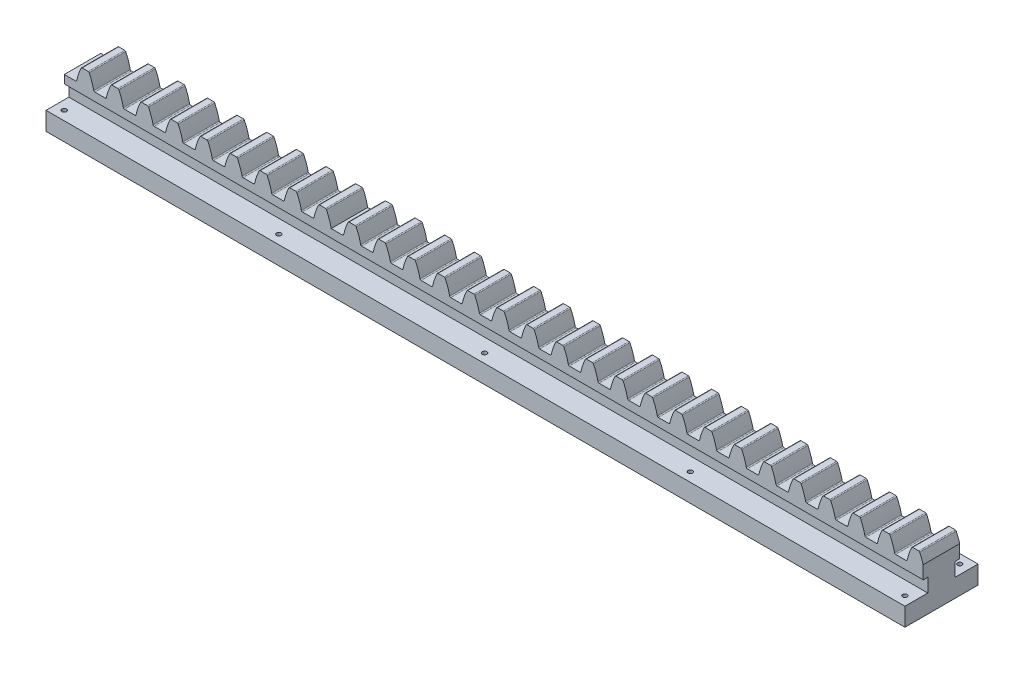
from build123d import *

# Parameters (mm, degrees)
BOSS_EXTRUDE2_DEPTH = 298.6405
CUT_EXTRUDE4_DEPTH  = 331.355130858
LPATTERN1_COUNT     = 30
LPATTERN1_PITCH     = 20.6248
FILLET1_R           = 0.762
SKETCH4_R           = 1.5875
CUT_EXTRUDE2_DEPTH  = 301.793065479


with BuildPart() as part:
    # Sketch1 → Boss-Extrude2 (new, symmetric)
    with BuildSketch(Plane(origin=(0, 0, 0), x_dir=(0, 0, -1), z_dir=(1, 0, 0))):
        Polygon((25.4, 0), (-25.4, 0), (-25.4, 12.7), (-9.525, 12.7), (-9.525, 22.225), (-12.7, 22.225), (-12.7, 38.1), (12.7, 38.1), (12.7, 22.225), (9.525, 22.225), (9.525, 12.7), (25.4, 12.7), align=None)
    extrude(amount=BOSS_EXTRUDE2_DEPTH, both=True)

    # Sketch6 → Cut-Extrude4 (cut, symmetric)
    with BuildSketch(Plane(origin=(23.474580109, 68.783919997, 0), x_dir=(1, 0, 0), z_dir=(0, 0, -1))):
        with BuildLine():
            Line((-322.115080109, 40.843919997), (-313.615080109, 40.843919997))
            ThreePointArc((-313.615080109, 40.843919997), (-312.202371676, 35.647727036), (-310.115080109, 30.683919997))
            Line((-310.115080109, 30.683919997), (-325.615080109, 30.683919997))
            ThreePointArc((-325.615080109, 30.683919997), (-323.527788542, 35.647727036), (-322.115080109, 40.843919997))
        make_face()
    cut_extrude4 = extrude(amount=CUT_EXTRUDE4_DEPTH, both=True, mode=Mode.SUBTRACT)

    # LPattern1: Cut-Extrude4 ×30
    with Locations(*[(i * LPATTERN1_PITCH, 0, 0) for i in range(1, LPATTERN1_COUNT)]):
        add(cut_extrude4, mode=Mode.SUBTRACT)

    # Fillet1
    fillet1_edges = [part.edges().sort_by_distance(p)[0] for p in [
        (-224.7661, 38.1, 0),
        (-219.6413, 38.1, 0),
        (-216.1413, 27.94, 0),
        (-207.6413, 27.94, 0),
        (-204.1413, 38.1, 0),
        (-199.0165, 38.1, 0),
        (-195.5165, 27.94, 0),
        (-187.0165, 27.94, 0),
        (-183.5165, 38.1, 0),
        (-178.3917, 38.1, 0),
        (-174.8917, 27.94, 0),
        (-166.3917, 27.94, 0),
        (-162.8917, 38.1, 0),
        (-157.7669, 38.1, 0),
        (-154.2669, 27.94, 0),
        (-145.7669, 27.94, 0),
        (-142.2669, 38.1, 0),
        (-137.1421, 38.1, 0),
        (-133.6421, 27.94, 0),
        (-125.1421, 27.94, 0),
        (-121.6421, 38.1, 0),
        (-116.5173, 38.1, 0),
        (-104.5173, 27.94, 0),
        (-101.0173, 38.1, 0),
        (-95.8925, 38.1, 0),
        (-92.3925, 27.94, 0),
        (-83.8925, 27.94, 0),
        (-80.3925, 38.1, 0),
        (-75.2677, 38.1, 0),
        (-71.7677, 27.94, 0),
        (-63.2677, 27.94, 0),
        (-59.7677, 38.1, 0),
        (-54.6429, 38.1, 0),
        (-51.1429, 27.94, 0),
        (-42.6429, 27.94, 0),
        (-39.1429, 38.1, 0),
        (-34.0181, 38.1, 0),
        (-30.5181, 27.94, 0),
        (-22.0181, 27.94, 0),
        (-18.5181, 38.1, 0),
        (-13.3933, 38.1, 0),
        (-9.8933, 27.94, 0),
        (-1.3933, 27.94, 0),
        (2.1067, 38.1, 0),
        (7.2315, 38.1, 0),
        (10.7315, 27.94, 0),
        (19.2315, 27.94, 0),
        (22.7315, 38.1, 0),
        (27.8563, 38.1, 0),
        (31.3563, 27.94, 0),
        (39.8563, 27.94, 0),
        (43.3563, 38.1, 0),
        (-290.1405, 27.94, 0),
        (-286.6405, 38.1, 0),
        (48.4811, 38.1, 0),
        (51.9811, 27.94, 0),
        (60.4811, 27.94, 0),
        (63.9811, 38.1, 0),
        (69.1059, 38.1, 0),
        (72.6059, 27.94, 0),
        (81.1059, 27.94, 0),
        (84.6059, 38.1, 0),
        (89.7307, 38.1, 0),
        (93.2307, 27.94, 0),
        (101.7307, 27.94, 0),
        (105.2307, 38.1, 0),
        (110.3555, 38.1, 0),
        (113.8555, 27.94, 0),
        (122.3555, 27.94, 0),
        (125.8555, 38.1, 0),
        (130.9803, 38.1, 0),
        (134.4803, 27.94, 0),
        (142.9803, 27.94, 0),
        (146.4803, 38.1, 0),
        (151.6051, 38.1, 0),
        (155.1051, 27.94, 0),
        (163.6051, 27.94, 0),
        (167.1051, 38.1, 0),
        (172.2299, 38.1, 0),
        (175.7299, 27.94, 0),
        (184.2299, 27.94, 0),
        (187.7299, 38.1, 0),
        (192.8547, 38.1, 0),
        (196.3547, 27.94, 0),
        (204.8547, 27.94, 0),
        (208.3547, 38.1, 0),
        (213.4795, 38.1, 0),
        (216.9795, 27.94, 0),
        (225.4795, 27.94, 0),
        (228.9795, 38.1, 0),
        (234.1043, 38.1, 0),
        (237.6043, 27.94, 0),
        (246.1043, 27.94, 0),
        (249.6043, 38.1, 0),
        (-281.5157, 38.1, 0),
        (-278.0157, 27.94, 0),
        (-269.5157, 27.94, 0),
        (-266.0157, 38.1, 0),
        (254.7291, 38.1, 0),
        (258.2291, 27.94, 0),
        (266.7291, 27.94, 0),
        (270.2291, 38.1, 0),
        (275.3539, 38.1, 0),
        (278.8539, 27.94, 0),
        (287.3539, 27.94, 0),
        (290.8539, 38.1, 0),
        (295.9787, 38.1, 0),
        (-260.8909, 38.1, 0),
        (-257.3909, 27.94, 0),
        (-248.8909, 27.94, 0),
        (-245.3909, 38.1, 0),
        (-240.2661, 38.1, 0),
        (-236.7661, 27.94, 0),
        (-228.2661, 27.94, 0),
    ]]
    fillet(fillet1_edges, radius=FILLET1_R)

    # Sketch4 → Cut-Extrude2 (cut, through all)
    with BuildSketch(Plane(origin=(0, 12.7, 0), x_dir=(1, 0, 0), z_dir=(0, 1, 0))):
        with Locations(Location((-292.2905, 19.05, 0), (0, 0, 270))):
            Circle(SKETCH4_R)
        with Locations(Location((-292.2905, -19.05, 0), (0, 0, 90))):
            Circle(SKETCH4_R)
        with Locations(Location((-143.0655, 19.05, 0), (0, 0, 270))):
            Circle(SKETCH4_R)
        with Locations(Location((-143.0655, -19.05, 0), (0, 0, 90))):
            Circle(SKETCH4_R)
        with Locations(Location((0, 19.05, 0), (0, 0, 270))):
            Circle(SKETCH4_R)
        with Locations(Location((0, -19.05, 0), (0, 0, 90))):
            Circle(SKETCH4_R)
        with Locations(Location((143.0655, -19.05, 0), (0, 0, 270))):
            Circle(SKETCH4_R)
        with Locations(Location((143.0655, 19.05, 0), (0, 0, 90))):
            Circle(SKETCH4_R)
        with Locations(Location((292.2905, -19.05, 0), (0, 0, 270))):
            Circle(SKETCH4_R)
        with Locations(Location((292.2905, 19.05, 0), (0, 0, 90))):
            Circle(SKETCH4_R)
    extrude(amount=-CUT_EXTRUDE2_DEPTH, mode=Mode.SUBTRACT)


solid = part.part
